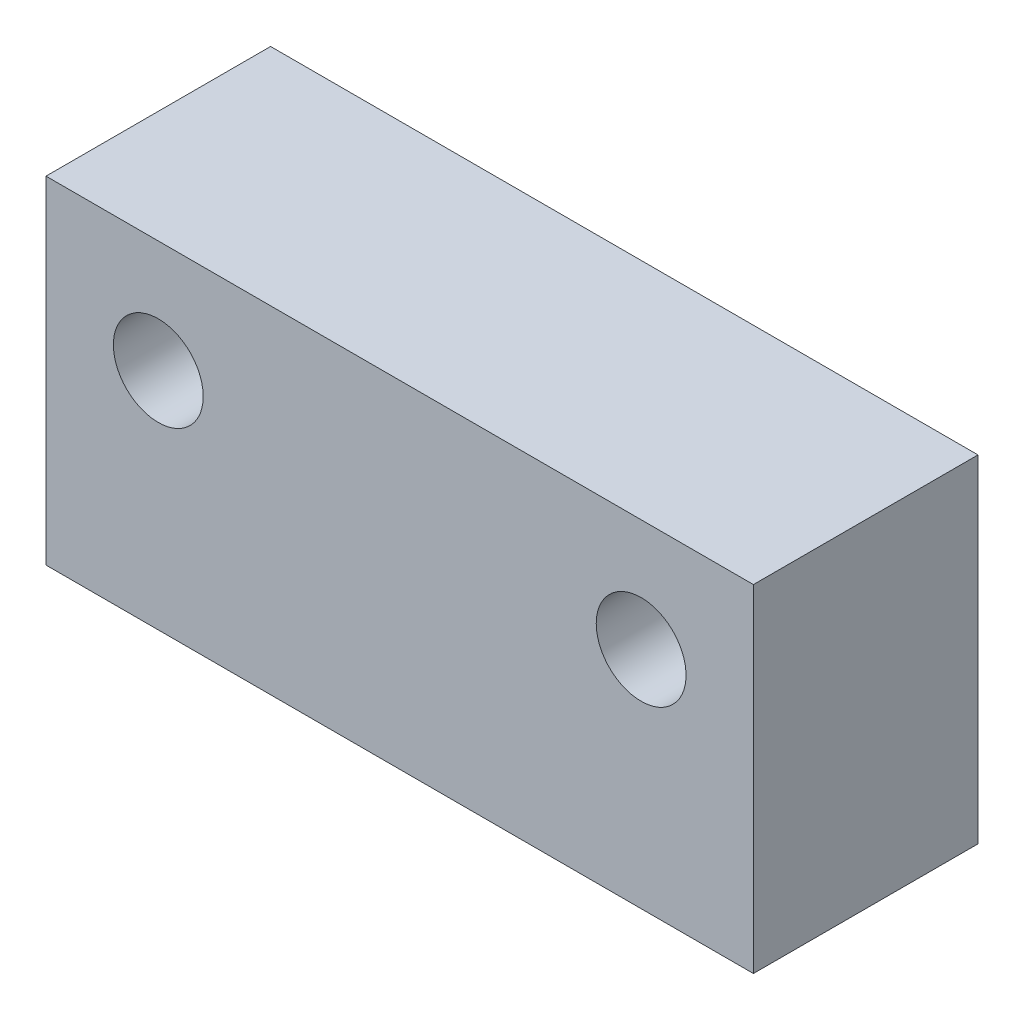
from build123d import *

# Parameters (mm, degrees)
SKETCH1_W           = 63
SKETCH1_H           = 30
SKETCH1_R           = 4
BOSS_EXTRUDE1_DEPTH = 20


with BuildPart() as part:
    # Sketch1 → Boss-Extrude1 (new body)
    with BuildSketch(Plane.XY):
        with Locations((31.5, 15)):
            Rectangle(SKETCH1_W, SKETCH1_H)
        with Locations((10, 20)):
            Circle(SKETCH1_R, mode=Mode.SUBTRACT)
        with Locations(Location((53, 20, 0), (0, 0, 180))):
            Circle(SKETCH1_R, mode=Mode.SUBTRACT)
    extrude(amount=BOSS_EXTRUDE1_DEPTH)


solid = part.part
